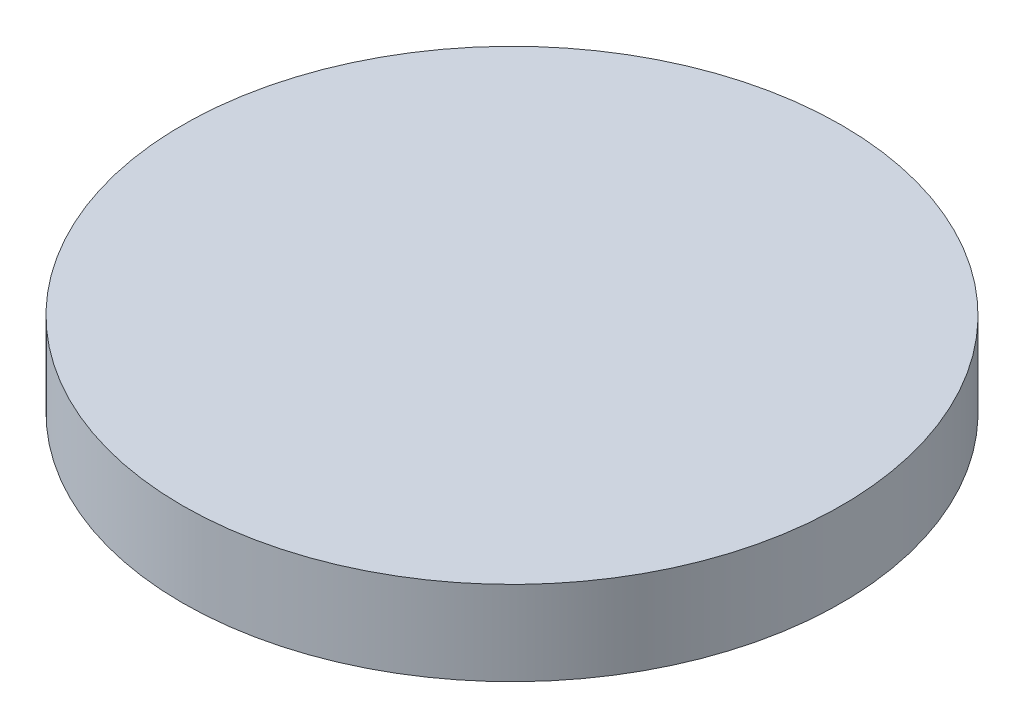
from build123d import *

# Parameters (mm, degrees)
SKETCH1_R           = 18.375
BOSS_EXTRUDE1_DEPTH = 4.698


with BuildPart() as part:
    # Sketch1 → Boss-Extrude1 (new body)
    with BuildSketch(Plane(origin=(0, 0, 0), x_dir=(1, 0, 0), z_dir=(0, 1, 0))):
        with Locations(Location((0, 0, 0), (0, 0, 270))):
            Circle(SKETCH1_R)
    extrude(amount=BOSS_EXTRUDE1_DEPTH)


solid = part.part
